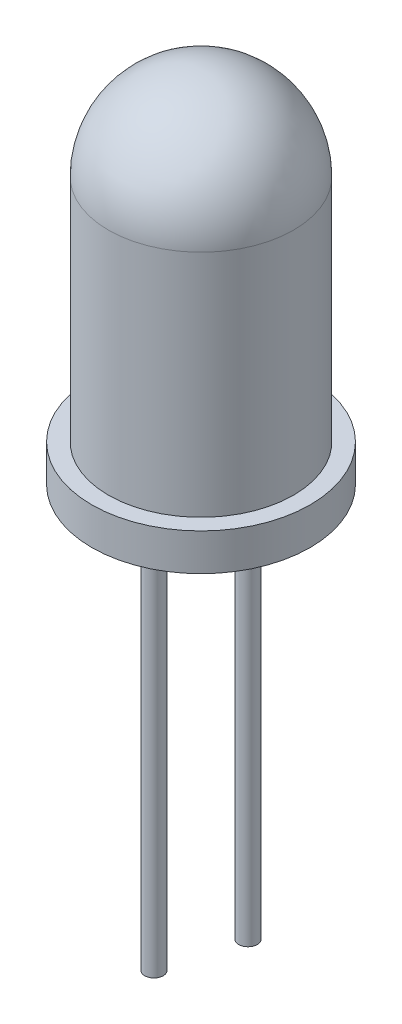
from build123d import *

# Parameters (mm, degrees)
SKETCH2_R           = 0.25
BOSS_EXTRUDE1_DEPTH = 10
SKETCH3_R           = 0.25
BOSS_EXTRUDE2_DEPTH = 12


with BuildPart() as part:
    # Sketch1 → Revolve1 (revolve)
    with BuildSketch(Plane.XY, mode=Mode.PRIVATE) as revolve1_sk:
        with BuildLine():
            Line((0, 0), (0, 9.7))
            ThreePointArc((0, 9.7), (1.767766953, 8.967766953), (2.5, 7.2))
            Line((2.5, 7.2), (2.5, 1))
            Line((2.5, 1), (2.95, 1))
            Line((2.95, 1), (2.95, 0))
            Line((2.95, 0), (0, 0))
        make_face()
    revolve(revolve1_sk.sketch.rotate(Axis((0, 0, 0), (0, 1, 0)), 90), axis=Axis((0, 0, 0), (0, 1, 0)))

    # Sketch2 → Boss-Extrude1 (add)
    with BuildSketch(Plane.XZ):
        with Locations(Location((1.27, 0, 0), (0, 0, 270))):
            Circle(SKETCH2_R)
    extrude(amount=BOSS_EXTRUDE1_DEPTH)

    # Sketch3 → Boss-Extrude2 (add)
    with BuildSketch(Plane.XZ):
        with Locations(Location((-1.27, 0, 0), (0, 0, 270))):
            Circle(SKETCH3_R)
    extrude(amount=BOSS_EXTRUDE2_DEPTH)


solid = part.part
